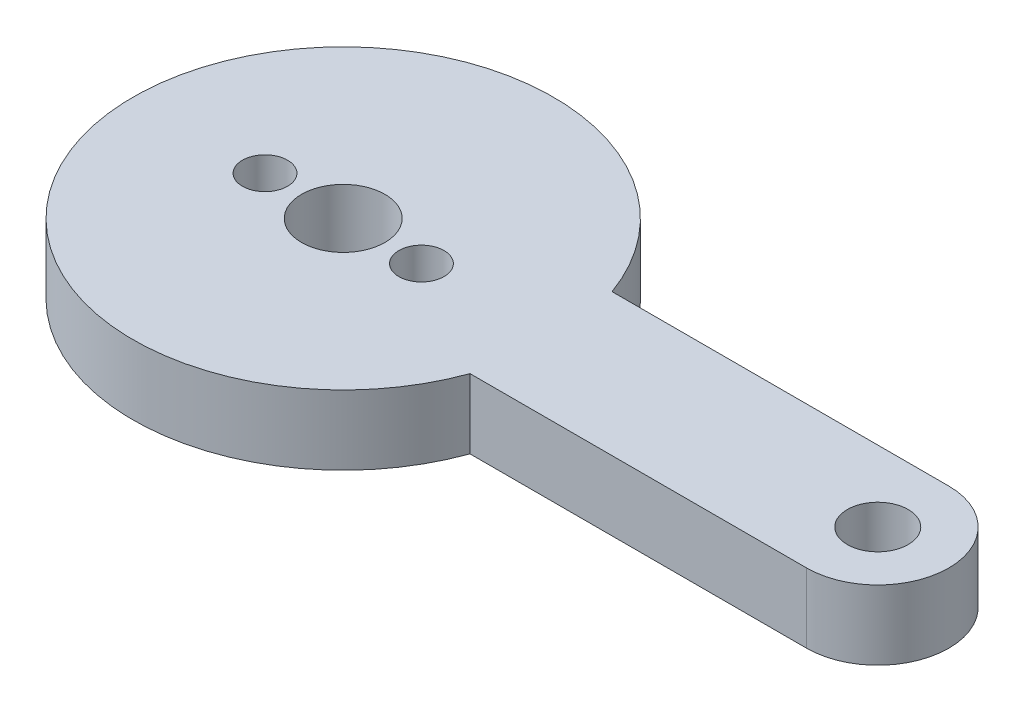
from build123d import *

# Parameters (mm, degrees)
SKETCH_2_R          = 1.75
EXTRUDE_1_DEPTH     = 4
SKETCH_3_R          = 2.4
SKETCH_3_R_2        = 1.3
CUT_EXTRUDE_1_DEPTH = 38.089795808


with BuildPart() as part:
    # 草图2 → 凸台-拉伸1 (new body)
    with BuildSketch(Plane(origin=(0, 0, 0), x_dir=(1, 0, 0), z_dir=(0, 1, 0))):
        with BuildLine():
            Line((30.75, 4.085109489), (11.378927035, 4.085109489))
            ThreePointArc((11.378927035, 4.085109489), (-12.09, 0), (11.378927035, -4.085109489))
            Line((11.378927035, -4.085109489), (30.75, -4.085109489))
            ThreePointArc((30.75, -4.085109489), (34.835109489, 0), (30.75, 4.085109489))
        make_face()
        with Locations(Location((30.75, 0, 0), (0, 0, 270))):
            Circle(SKETCH_2_R, mode=Mode.SUBTRACT)
        with Locations(Location((0, 0, 0), (0, 0, 270))):
            Circle(SKETCH_2_R, mode=Mode.SUBTRACT)
    extrude(amount=EXTRUDE_1_DEPTH)

    # 草图3 → 切除-拉伸1 (cut, through all)
    with BuildSketch(Plane(origin=(0, 4, 0), x_dir=(1, 0, 0), z_dir=(0, 1, 0))):
        with Locations(Location((0, 0, 0), (0, 0, 270))):
            Circle(SKETCH_3_R)
        with Locations(Location((4.5, 0, 0), (0, 0, 270))):
            Circle(SKETCH_3_R_2)
        with Locations(Location((-4.5, 0, 0), (0, 0, 270))):
            Circle(SKETCH_3_R_2)
    extrude(amount=-CUT_EXTRUDE_1_DEPTH, mode=Mode.SUBTRACT)


solid = part.part
